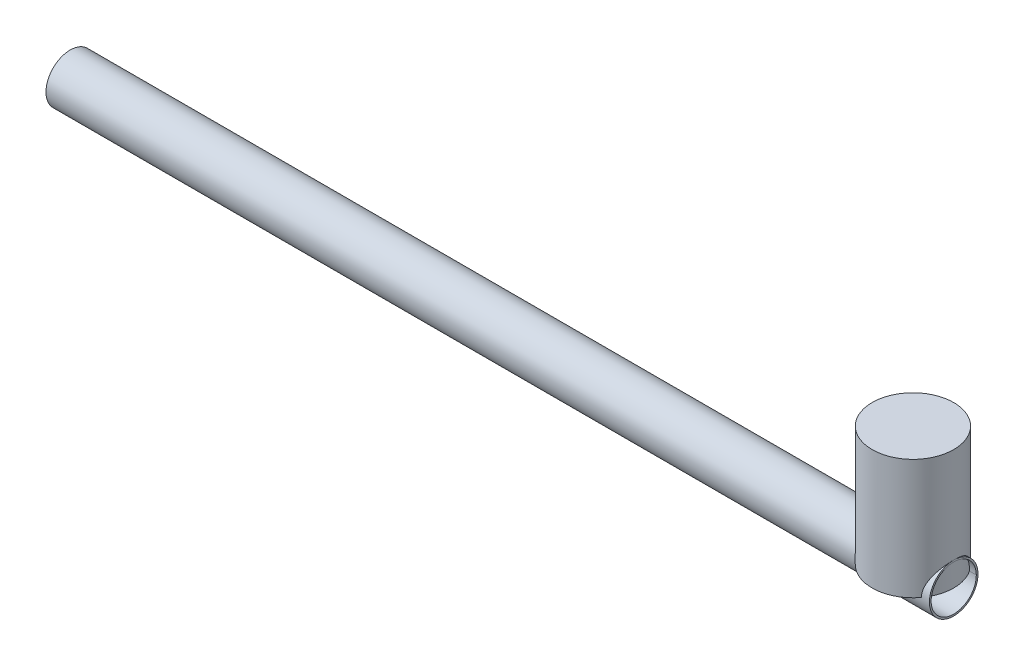
from build123d import *

# Parameters (mm, degrees)
SKETCH1_R           = 12.7
SKETCH1_R_2         = 11.811
BOSS_EXTRUDE1_DEPTH = 461.982
SKETCH2_R           = 21.33128873
BOSS_EXTRUDE2_DEPTH = 62.7


with BuildPart() as part:
    # Sketch1 → Boss-Extrude1 (new body)
    with BuildSketch(Plane(origin=(0, 0, 0), x_dir=(0, 0, -1), z_dir=(1, 0, 0))):
        Circle(SKETCH1_R)
        Circle(SKETCH1_R_2, mode=Mode.SUBTRACT)
    extrude(amount=BOSS_EXTRUDE1_DEPTH)

    # Sketch2 → Boss-Extrude2 (add)
    with BuildSketch(Plane(origin=(0, 0, 0), x_dir=(1, 0, 0), z_dir=(0, 1, 0))):
        with Locations(Location((440.65071127, 0, 0), (0, 0, 143.461018273))):
            Circle(SKETCH2_R)
    extrude(amount=BOSS_EXTRUDE2_DEPTH)


solid = part.part
